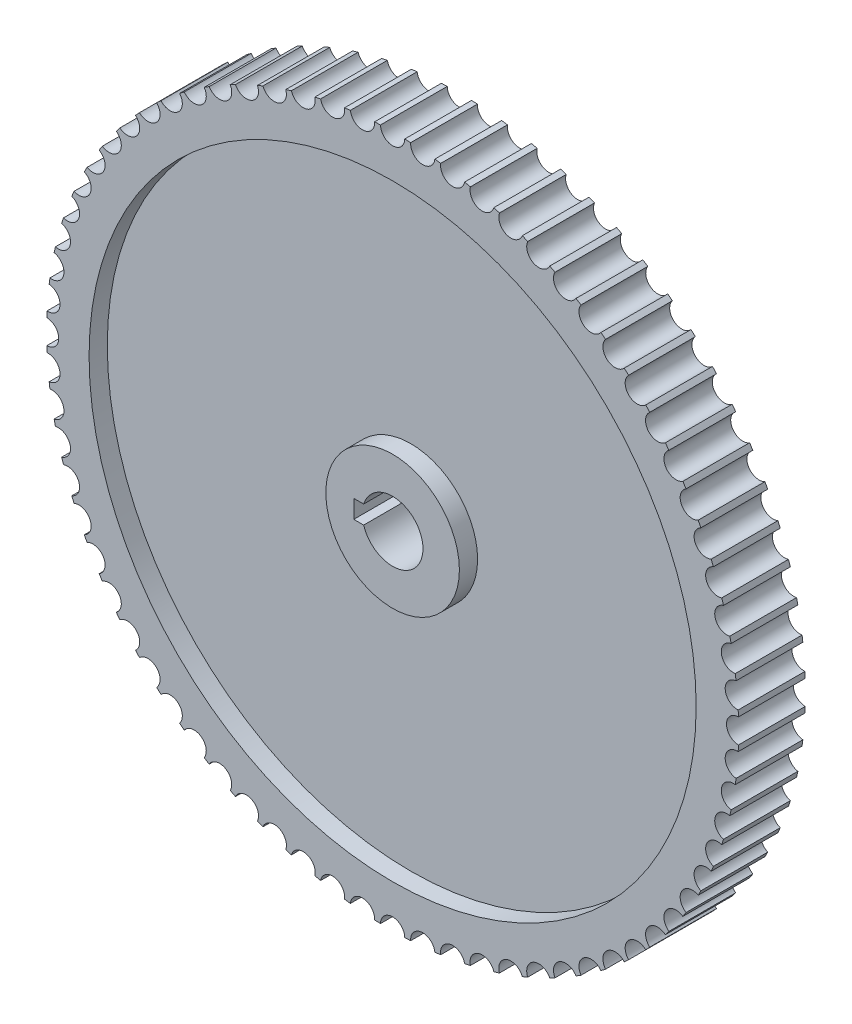
from build123d import *

# Parameters (mm, degrees)
SKETCH1_R           = 57
BOSS_EXTRUDE1_DEPTH = 11
SKETCH5_R           = 5
CUT_EXTRUDE4_DEPTH  = 10
KEYWAY_DEPTH        = 90.899864616
SKETCH8_R           = 50
SKETCH8_R_2         = 11
CUT_EXTRUDE6_DEPTH  = 3
CUT_EXTRUDE7_START  = -3
SKETCH9_R           = 50
SKETCH9_R_2         = 11
CUT_EXTRUDE7_DEPTH  = 3
SKETCH10_R          = 2
CUT_EXTRUDE8_DEPTH  = 11


with BuildPart() as part:
    # Sketch1 → Boss-Extrude1 (new body)
    with BuildSketch(Plane.XY):
        Circle(SKETCH1_R)
    extrude(amount=BOSS_EXTRUDE1_DEPTH)

    # Sketch5 → Cut-Extrude4 (cut)
    with BuildSketch(Plane.XY.offset(11)):
        Circle(SKETCH5_R)
    extrude(amount=-CUT_EXTRUDE4_DEPTH, mode=Mode.SUBTRACT)

    # KeySketch → Keyway (cut, through all)
    with BuildSketch(Plane(origin=(-4.825591798, -7.331810614, 11), x_dir=(1, 0, 0), z_dir=(0, 0, 1))):
        with BuildLine():
            Line((0.055895791, 5.831810614), (-1.574408202, 5.831810614))
            Line((-1.574408202, 5.831810614), (-1.574408202, 8.831810614))
            Line((-1.574408202, 8.831810614), (0.055895791, 8.831810614))
            ThreePointArc((0.055895791, 8.831810614), (9.825591798, 7.331810614), (0.055895791, 5.831810614))
        make_face()
    extrude(amount=-KEYWAY_DEPTH, mode=Mode.SUBTRACT)

    # Sketch8 → Cut-Extrude6 (cut)
    with BuildSketch(Plane(origin=(0, 0, 0), x_dir=(-1, 0, 0), z_dir=(0, 0, -1))):
        Circle(SKETCH8_R)
        Circle(SKETCH8_R_2, mode=Mode.SUBTRACT)
    extrude(amount=-CUT_EXTRUDE6_DEPTH, mode=Mode.SUBTRACT)

    # Sketch9 → Cut-Extrude7 (cut)
    with BuildSketch(Plane.XY.offset(11).offset(CUT_EXTRUDE7_START)):
        with Locations(Location((0, 0, 0), (0, 0, 180))):
            Circle(SKETCH9_R)
        with Locations(Location((0, 0, 0), (0, 0, 180))):
            Circle(SKETCH9_R_2, mode=Mode.SUBTRACT)
    extrude(amount=CUT_EXTRUDE7_DEPTH, mode=Mode.SUBTRACT)

    # Sketch10 → Cut-Extrude8 (cut)
    with BuildSketch(Plane.XY.offset(11)):
        with Locations((0, 57)):
            Circle(SKETCH10_R)
        with Locations((4.967877337, 56.783097791)):
            Circle(SKETCH10_R)
        with Locations((9.897946127, 56.134041922)):
            Circle(SKETCH10_R)
        with Locations((14.752685571, 55.057772098)):
            Circle(SKETCH10_R)
        with Locations((19.49514817, 53.562479385)):
            Circle(SKETCH10_R)
        with Locations((24.089240919, 51.659543861)):
            Circle(SKETCH10_R)
        with Locations((28.5, 49.363448016)):
            Circle(SKETCH10_R)
        with Locations((32.693856872, 46.691666524)):
            Circle(SKETCH10_R)
        with Locations((36.638893752, 43.664533258)):
            Circle(SKETCH10_R)
        with Locations((40.305086528, 40.305086528)):
            Circle(SKETCH10_R)
        with Locations((43.664533258, 36.638893752)):
            Circle(SKETCH10_R)
        with Locations((46.691666524, 32.693856872)):
            Circle(SKETCH10_R)
        with Locations((49.363448016, 28.5)):
            Circle(SKETCH10_R)
        with Locations((51.659543861, 24.089240919)):
            Circle(SKETCH10_R)
        with Locations((53.562479385, 19.49514817)):
            Circle(SKETCH10_R)
        with Locations((55.057772098, 14.752685571)):
            Circle(SKETCH10_R)
        with Locations((56.134041922, 9.897946127)):
            Circle(SKETCH10_R)
        with Locations((56.783097791, 4.967877337)):
            Circle(SKETCH10_R)
        with Locations((57, 0)):
            Circle(SKETCH10_R)
        with Locations((56.783097791, -4.967877337)):
            Circle(SKETCH10_R)
        with Locations((56.134041922, -9.897946127)):
            Circle(SKETCH10_R)
        with Locations((55.057772098, -14.752685571)):
            Circle(SKETCH10_R)
        with Locations((53.562479385, -19.49514817)):
            Circle(SKETCH10_R)
        with Locations((51.659543861, -24.089240919)):
            Circle(SKETCH10_R)
        with Locations((49.363448016, -28.5)):
            Circle(SKETCH10_R)
        with Locations((46.691666524, -32.693856872)):
            Circle(SKETCH10_R)
        with Locations((43.664533258, -36.638893752)):
            Circle(SKETCH10_R)
        with Locations((40.305086528, -40.305086528)):
            Circle(SKETCH10_R)
        with Locations((36.638893752, -43.664533258)):
            Circle(SKETCH10_R)
        with Locations((32.693856872, -46.691666524)):
            Circle(SKETCH10_R)
        with Locations((28.5, -49.363448016)):
            Circle(SKETCH10_R)
        with Locations((24.089240919, -51.659543861)):
            Circle(SKETCH10_R)
        with Locations((19.49514817, -53.562479385)):
            Circle(SKETCH10_R)
        with Locations((14.752685571, -55.057772098)):
            Circle(SKETCH10_R)
        with Locations((9.897946127, -56.134041922)):
            Circle(SKETCH10_R)
        with Locations((4.967877337, -56.783097791)):
            Circle(SKETCH10_R)
        with Locations((0, -57)):
            Circle(SKETCH10_R)
        with Locations((-4.967877337, -56.783097791)):
            Circle(SKETCH10_R)
        with Locations((-9.897946127, -56.134041922)):
            Circle(SKETCH10_R)
        with Locations((-14.752685571, -55.057772098)):
            Circle(SKETCH10_R)
        with Locations((-19.49514817, -53.562479385)):
            Circle(SKETCH10_R)
        with Locations((-24.089240919, -51.659543861)):
            Circle(SKETCH10_R)
        with Locations((-28.5, -49.363448016)):
            Circle(SKETCH10_R)
        with Locations((-32.693856872, -46.691666524)):
            Circle(SKETCH10_R)
        with Locations((-36.638893752, -43.664533258)):
            Circle(SKETCH10_R)
        with Locations((-40.305086528, -40.305086528)):
            Circle(SKETCH10_R)
        with Locations((-43.664533258, -36.638893752)):
            Circle(SKETCH10_R)
        with Locations((-46.691666524, -32.693856872)):
            Circle(SKETCH10_R)
        with Locations((-49.363448016, -28.5)):
            Circle(SKETCH10_R)
        with Locations((-51.659543861, -24.089240919)):
            Circle(SKETCH10_R)
        with Locations((-53.562479385, -19.49514817)):
            Circle(SKETCH10_R)
        with Locations((-55.057772098, -14.752685571)):
            Circle(SKETCH10_R)
        with Locations((-56.134041922, -9.897946127)):
            Circle(SKETCH10_R)
        with Locations((-56.783097791, -4.967877337)):
            Circle(SKETCH10_R)
        with Locations((-57, 0)):
            Circle(SKETCH10_R)
        with Locations((-56.783097791, 4.967877337)):
            Circle(SKETCH10_R)
        with Locations((-56.134041922, 9.897946127)):
            Circle(SKETCH10_R)
        with Locations((-55.057772098, 14.752685571)):
            Circle(SKETCH10_R)
        with Locations((-53.562479385, 19.49514817)):
            Circle(SKETCH10_R)
        with Locations((-51.659543861, 24.089240919)):
            Circle(SKETCH10_R)
        with Locations((-49.363448016, 28.5)):
            Circle(SKETCH10_R)
        with Locations((-46.691666524, 32.693856872)):
            Circle(SKETCH10_R)
        with Locations((-43.664533258, 36.638893752)):
            Circle(SKETCH10_R)
        with Locations((-40.305086528, 40.305086528)):
            Circle(SKETCH10_R)
        with Locations((-36.638893752, 43.664533258)):
            Circle(SKETCH10_R)
        with Locations((-32.693856872, 46.691666524)):
            Circle(SKETCH10_R)
        with Locations((-28.5, 49.363448016)):
            Circle(SKETCH10_R)
        with Locations((-24.089240919, 51.659543861)):
            Circle(SKETCH10_R)
        with Locations((-19.49514817, 53.562479385)):
            Circle(SKETCH10_R)
        with Locations((-14.752685571, 55.057772098)):
            Circle(SKETCH10_R)
        with Locations((-9.897946127, 56.134041922)):
            Circle(SKETCH10_R)
        with Locations((-4.967877337, 56.783097791)):
            Circle(SKETCH10_R)
    extrude(amount=-CUT_EXTRUDE8_DEPTH, mode=Mode.SUBTRACT)


solid = part.part
